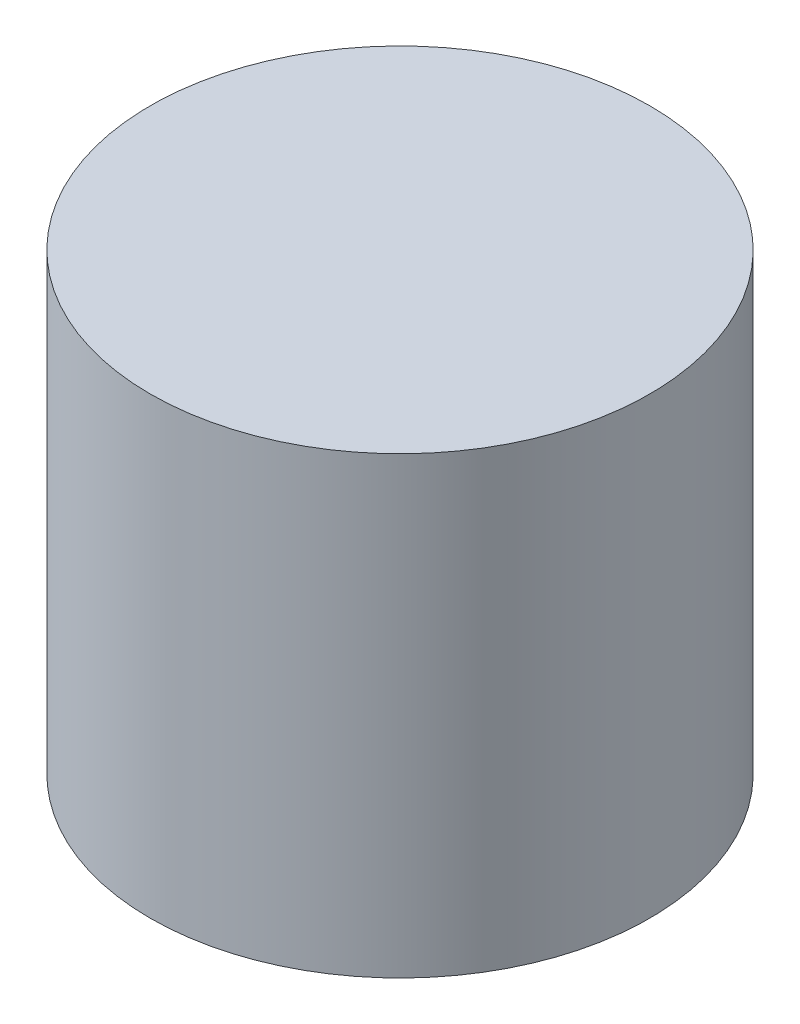
from build123d import *

# Parameters (mm, degrees)
SKETCH1_R           = 11
BOSS_EXTRUDE1_DEPTH = 20


with BuildPart() as part:
    # Sketch1 → Boss-Extrude1 (new body)
    with BuildSketch(Plane(origin=(0, 0, 0), x_dir=(1, 0, 0), z_dir=(0, 1, 0))):
        with Locations(Location((0, 0, 0), (0, 0, 270))):
            Circle(SKETCH1_R)
    extrude(amount=BOSS_EXTRUDE1_DEPTH)


solid = part.part
